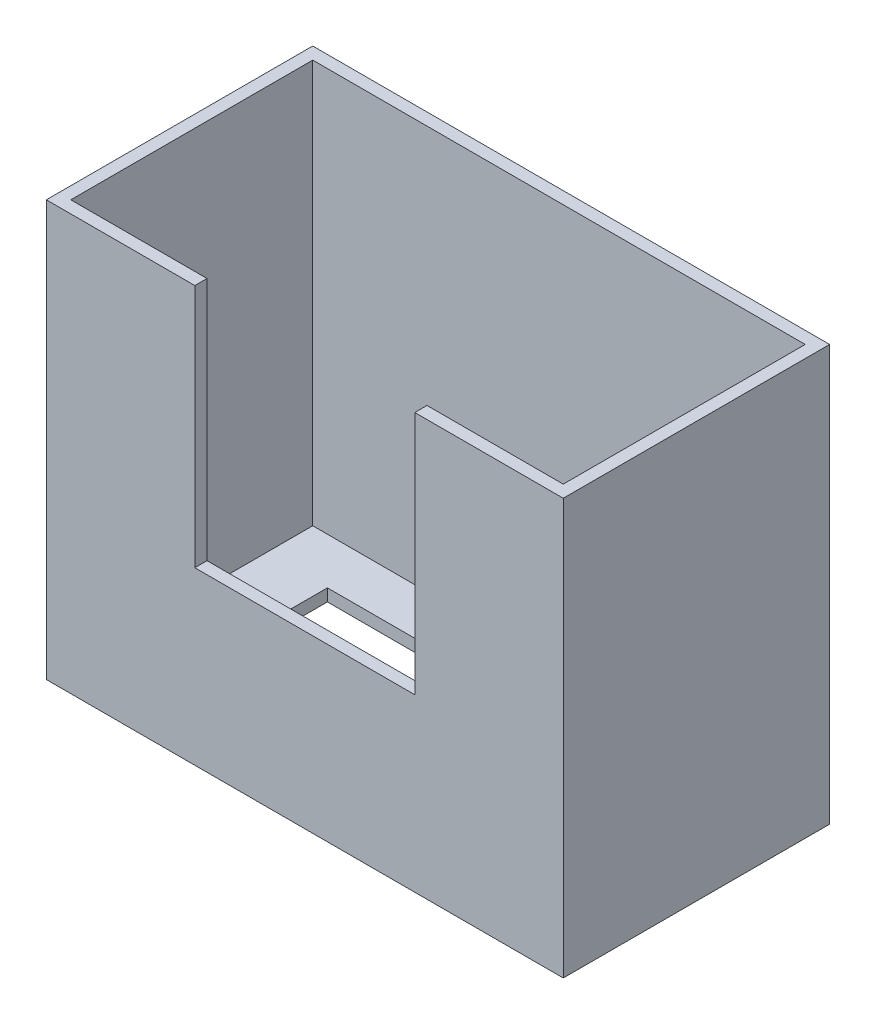
from build123d import *

# Parameters (mm, degrees)
SKETCH6_W           = 201.5
SKETCH6_H           = 99
BOSS_EXTRUDE1_DEPTH = 165
SHELL1_T            = 5
SKETCH7_W           = 150
SKETCH7_H           = 40
CUT_EXTRUDE1_DEPTH  = 165
CUT_EXTRUDE2_REACH  = 287.917
SKETCH8_W           = 90
SKETCH8_H           = 100


with BuildPart() as part:
    # Sketch6 → Boss-Extrude1 (new body)
    with BuildSketch(Plane(origin=(0, 0, 0), x_dir=(1, 0, 0), z_dir=(0, 1, 0))):
        with Locations((100.75, 49.5)):
            Rectangle(SKETCH6_W, SKETCH6_H)
    extrude(amount=BOSS_EXTRUDE1_DEPTH)

    # Shell1
    shell1_openings = [part.faces().sort_by_distance(p)[0] for p in [
        (100.75, 165, -49.5),
    ]]
    offset(amount=SHELL1_T, openings=shell1_openings, kind=Kind.INTERSECTION)

    # Sketch7 → Cut-Extrude1 (cut)
    with BuildSketch(Plane(origin=(0, 0, 0), x_dir=(1, 0, 0), z_dir=(0, 1, 0))):
        with Locations((100, 60)):
            Rectangle(SKETCH7_W, SKETCH7_H)
    extrude(amount=-CUT_EXTRUDE1_DEPTH, mode=Mode.SUBTRACT)

    # Sketch8 → Cut-Extrude2 (cut, up to next)
    with BuildSketch(Plane.XY.offset(5), mode=Mode.PRIVATE) as cut_extrude2_sk1:
        with Locations((100.75, 115)):
            Rectangle(SKETCH8_W, SKETCH8_H)
    cut_extrude2_tool1 = extrude(cut_extrude2_sk1.sketch, amount=-CUT_EXTRUDE2_REACH, mode=Mode.PRIVATE) & part.part
    add(cut_extrude2_tool1.solids().sort_by_distance((100.75, 115, 5))[0], mode=Mode.SUBTRACT)


solid = part.part
